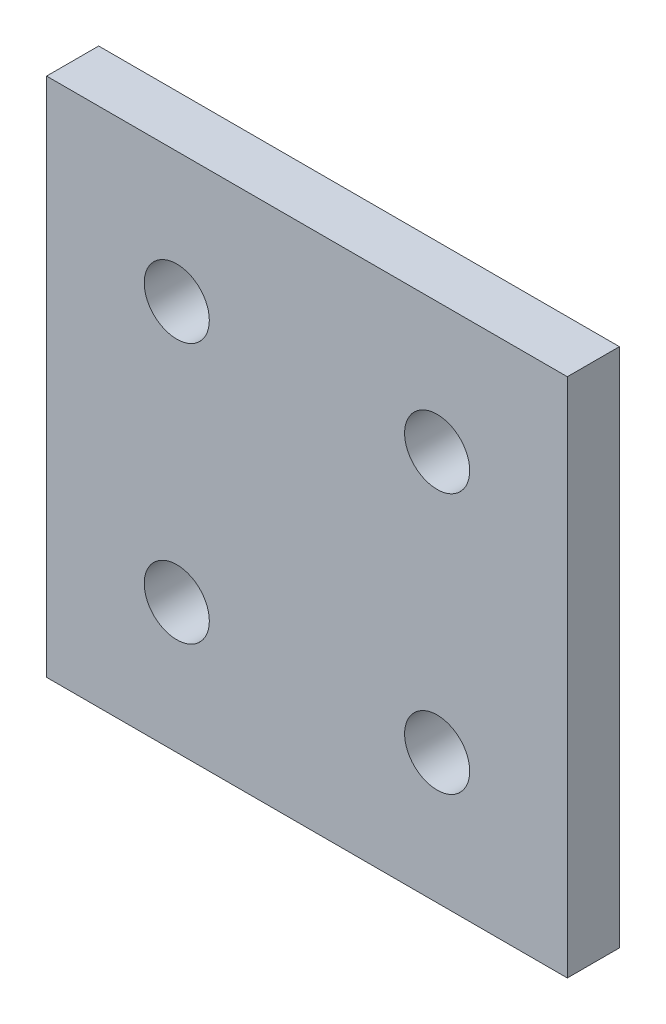
from build123d import *

# Parameters (mm, degrees)
SKETCH1_W           = 40
SKETCH1_H           = 40
SKETCH1_R           = 2.5
BOSS_EXTRUDE1_DEPTH = 4


with BuildPart() as part:
    # Sketch1 → Boss-Extrude1 (new body)
    with BuildSketch(Plane.XY):
        Rectangle(SKETCH1_W, SKETCH1_H)
        with Locations((-10, 10)):
            Circle(SKETCH1_R, mode=Mode.SUBTRACT)
        with Locations((10, 10)):
            Circle(SKETCH1_R, mode=Mode.SUBTRACT)
        with Locations((10, -10)):
            Circle(SKETCH1_R, mode=Mode.SUBTRACT)
        with Locations((-10, -10)):
            Circle(SKETCH1_R, mode=Mode.SUBTRACT)
    extrude(amount=BOSS_EXTRUDE1_DEPTH)


solid = part.part
